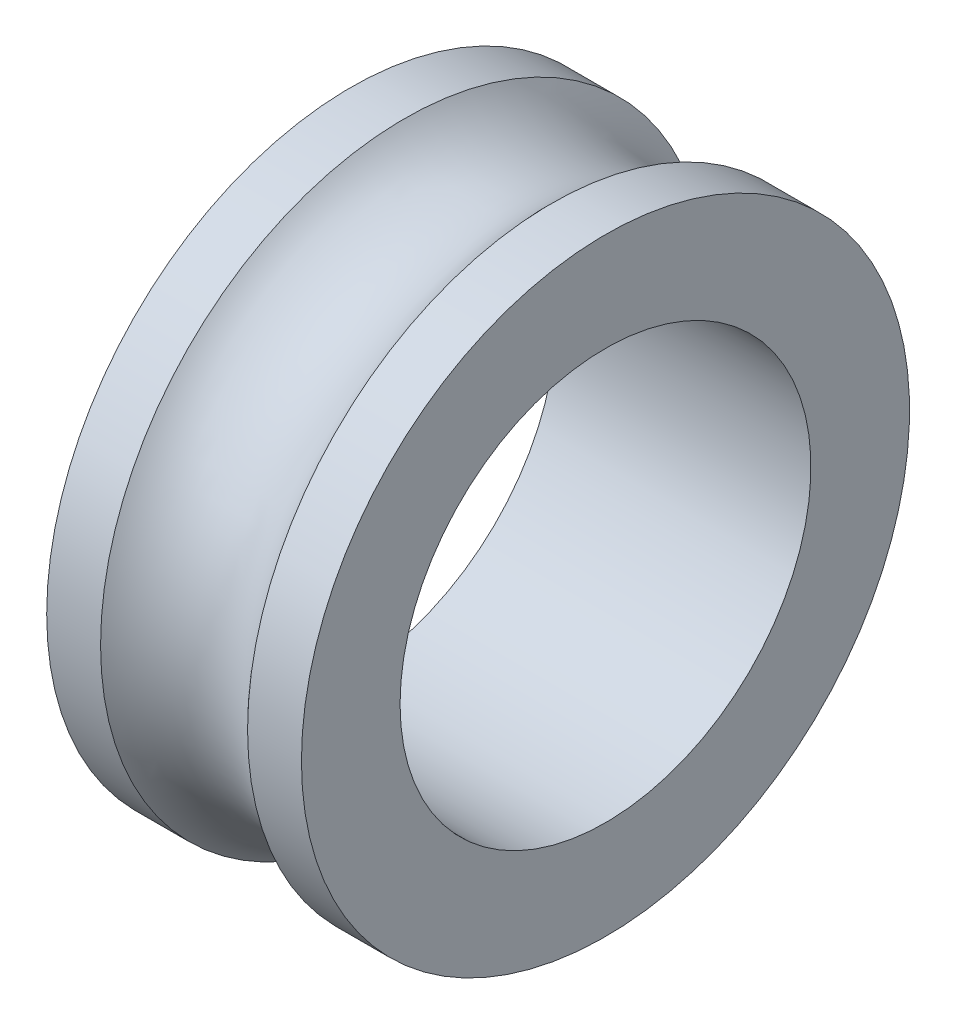
from build123d import *


with BuildPart() as part:
    # Sketch1 → Revolve1 (revolve)
    with BuildSketch(Plane.XY, mode=Mode.PRIVATE) as revolve1_sk:
        with BuildLine():
            Line((-15.5, 37), (-8.94427191, 37))
            ThreePointArc((-8.94427191, 37), (0, 33), (8.94427191, 37))
            Line((8.94427191, 37), (15.5, 37))
            Line((15.5, 37), (15.5, 25))
            Line((15.5, 25), (-15.5, 25))
            Line((-15.5, 25), (-15.5, 37))
        make_face()
    revolve(revolve1_sk.sketch.rotate(Axis((0, 0, 0), (1, 0, 0)), 90), axis=Axis((0, 0, 0), (1, 0, 0)))


solid = part.part
